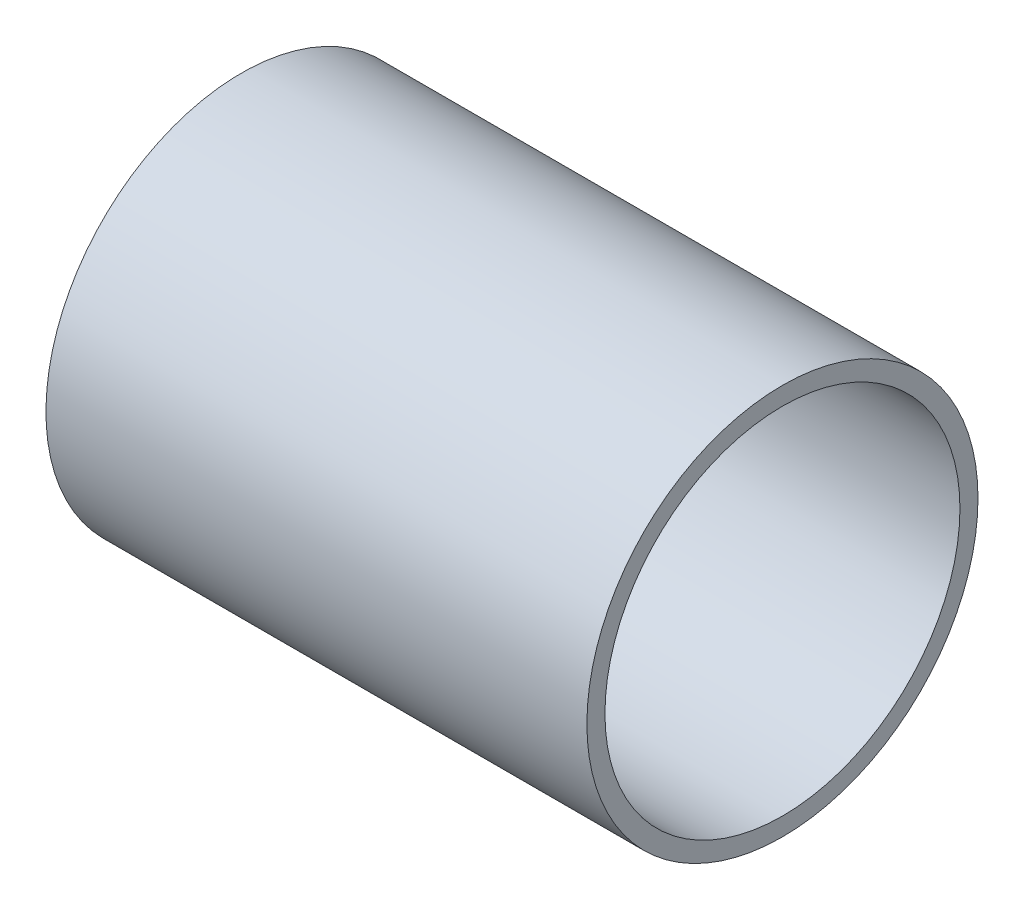
from build123d import *

# Parameters (mm, degrees)
EXTRUDE_THIN1_DEPTH      = 44.7
EXTRUDE_THIN1_DEPTH_BACK = 45.2
SKETCH1_R                = 32.5
SKETCH1_R_2              = 29.5


with BuildPart() as part:
    # Sketch1 → Extrude-Thin1 (new, two sides: drawn at the far end of the back side and taken through both)
    with BuildSketch(Plane(origin=(0, 0, 0), x_dir=(0, 0, -1), z_dir=(1, 0, 0)).offset(-EXTRUDE_THIN1_DEPTH_BACK)):
        Circle(SKETCH1_R)
        Circle(SKETCH1_R_2, mode=Mode.SUBTRACT)
    extrude(amount=EXTRUDE_THIN1_DEPTH + EXTRUDE_THIN1_DEPTH_BACK)


solid = part.part
